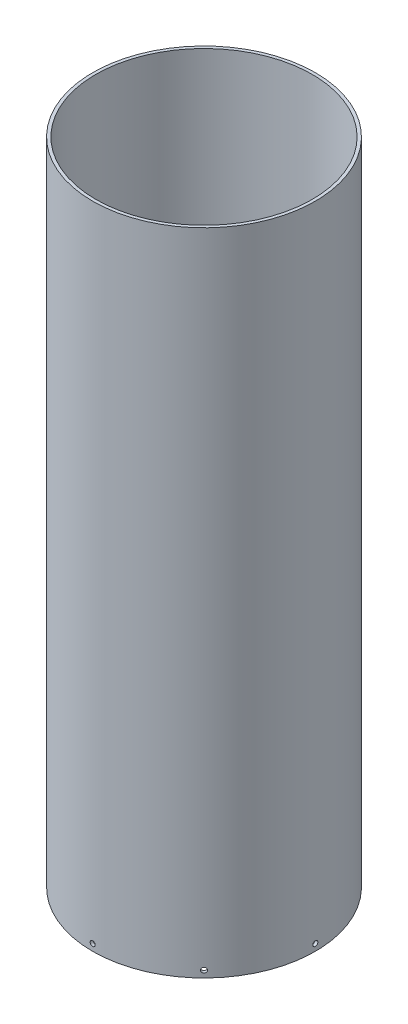
from build123d import *

# Parameters (mm, degrees)
SKETCH1_R           = 78.359
SKETCH1_R_2         = 76.2
BOSS_EXTRUDE1_DEPTH = 457.2
SKETCH2_R           = 1.750000056
CUT_EXTRUDE1_DEPTH  = 471.438206104
CIRPATTERN1_COUNT   = 8


with BuildPart() as part:
    # Sketch1 → Boss-Extrude1 (new body)
    with BuildSketch(Plane(origin=(0, 0, 0), x_dir=(1, 0, 0), z_dir=(0, 1, 0))):
        with Locations(Location((0, 0, 0), (0, 0, 270))):
            Circle(SKETCH1_R)
        with Locations(Location((0, 0, 0), (0, 0, 270))):
            Circle(SKETCH1_R_2, mode=Mode.SUBTRACT)
    extrude(amount=BOSS_EXTRUDE1_DEPTH)

    # Sketch2 → Cut-Extrude1 (cut, through all)
    with BuildSketch(Plane.XY):
        with Locations(Location((0, 4.7625, 0), (0, 0, 90))):
            Circle(SKETCH2_R)
    cut_extrude1 = extrude(amount=-CUT_EXTRUDE1_DEPTH, mode=Mode.SUBTRACT)

    # CirPattern1: Cut-Extrude1 ×8 about axis
    cirpattern1_axis = Axis((0, 457.2, 0), (0, -1, 0))
    for i in range(1, CIRPATTERN1_COUNT):
        add(cut_extrude1.rotate(cirpattern1_axis, i * 360 / CIRPATTERN1_COUNT), mode=Mode.SUBTRACT)


solid = part.part
